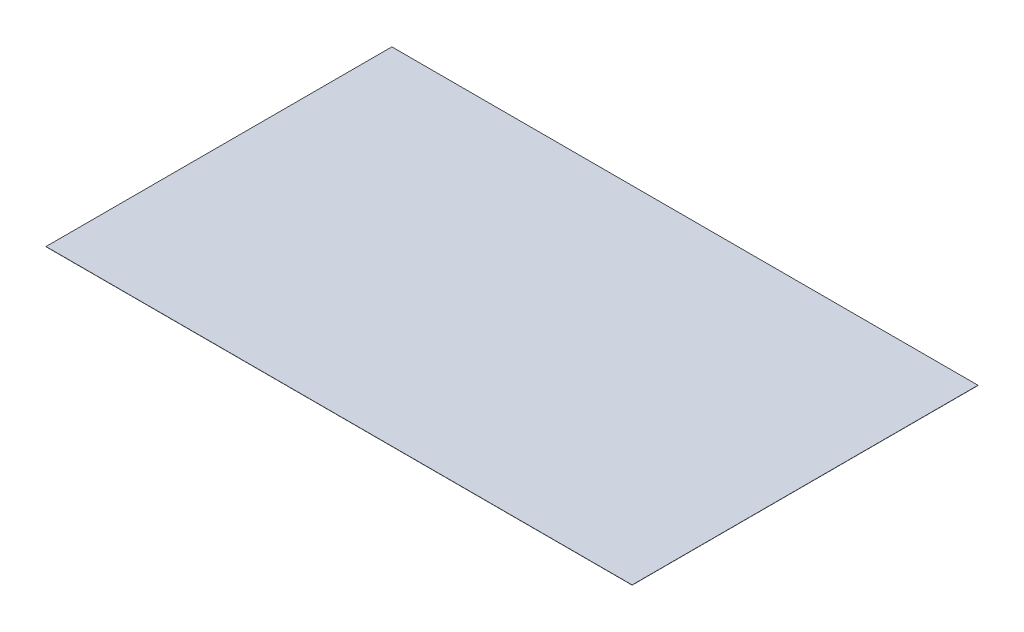
from build123d import *

# Parameters (mm, degrees)
SKETCH_1_W      = 330.768627623
SKETCH_1_H      = 195.170153705
EXTRUDE_1_DEPTH = 0.1


with BuildPart() as part:
    # 草图1 → 凸台-拉伸1 (new body)
    with BuildSketch(Plane(origin=(0, 0, 0), x_dir=(1, 0, 0), z_dir=(0, 1, 0))):
        with Locations((-5.207314667, -1.666340694)):
            Rectangle(SKETCH_1_W, SKETCH_1_H)
    extrude(amount=EXTRUDE_1_DEPTH)


solid = part.part
